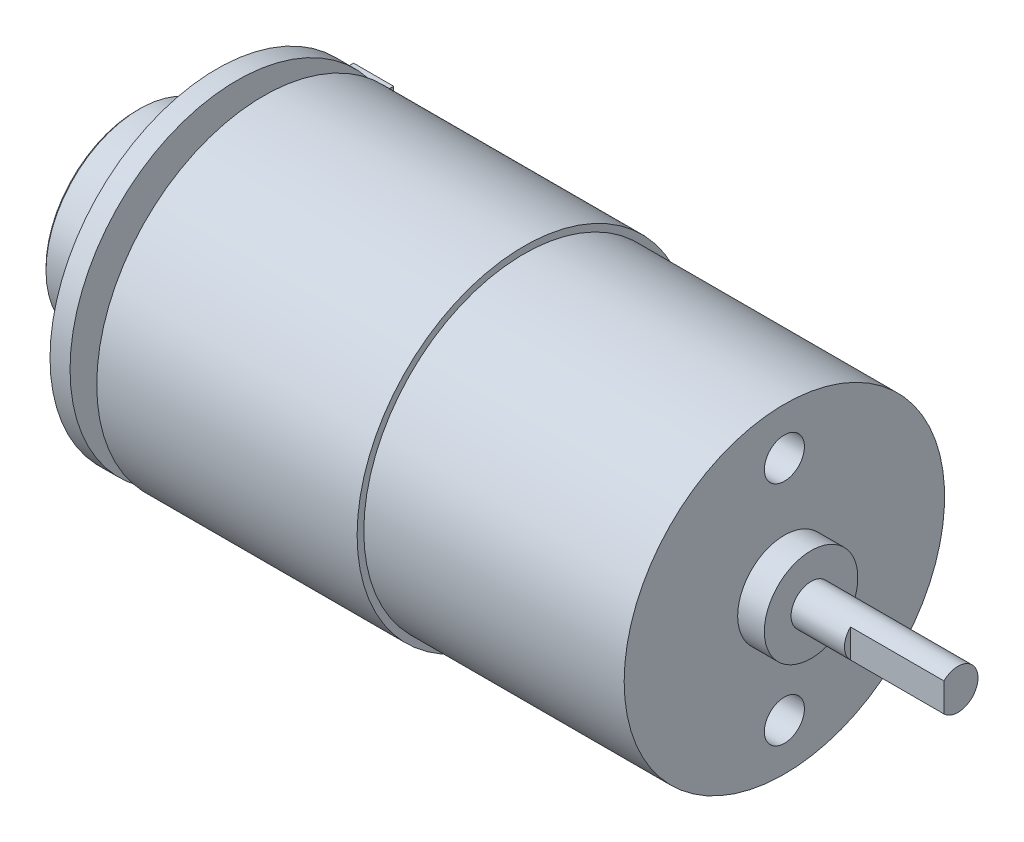
from build123d import *

# Parameters (mm, degrees)
SKETCH_2_R               = 1.5
CUT_EXTRUDE_1_DEPTH      = 3
SKETCH_3_W               = 0.5
SKETCH_3_H               = 3
EXTRUDE_1_DEPTH          = 2
EXTRUDE_START            = 1.5
SKETCH_4_R               = 12.5
EXTRUDE_2_DEPTH          = 1.5
SKETCH_5_R               = 0.5
EXTRUDE_3_DEPTH          = 1
SKETCH_6_R               = 7
EXTRUDE_4_DEPTH          = 5
SKETCH_7_W               = 5
SKETCH_7_H               = 9.498376428
EXTRUDE_5_DEPTH          = 3
CHAMFER_1_SIZE           = 0.2
CUT_EXTRUDE_2_DEPTH      = 38.251363929
CUT_EXTRUDE_2_DEPTH_BACK = 38.251363929
SKETCH_8_W               = 7
SKETCH_8_H               = 0.45


with BuildPart() as part:
    # 草图1 → 旋转1 (revolve)
    with BuildSketch(Plane.XY, mode=Mode.PRIVATE) as revolve_1_sk:
        Polygon((0, 12), (0, 12.5), (-19.5, 12.5), (-19.5, 0), (19.5, 0), (32.5, 0), (32.5, 1.5), (21.5, 1.5), (21.5, 3.5), (19.5, 3.5), (19.5, 12), align=None)
    revolve(revolve_1_sk.sketch.rotate(Axis((-61.965581957, 0, 0), (1, 0, 0)), 90), axis=Axis((-61.965581957, 0, 0), (1, 0, 0)))

    # 草图2 → 切除-拉伸1 (cut)
    with BuildSketch(Plane(origin=(19.5, 0, 0), x_dir=(0, 0, -1), z_dir=(1, 0, 0))):
        with Locations((0, -8.5)):
            Circle(SKETCH_2_R)
        with Locations(Location((0, 8.5, 0), (0, 0, 180))):
            Circle(SKETCH_2_R)
    extrude(amount=-CUT_EXTRUDE_1_DEPTH, mode=Mode.SUBTRACT)

    # 草图3 → 凸台-拉伸1 (add)
    with BuildSketch(Plane.ZY.offset(19.5)):
        with Locations((-9.404663304, 0)):
            Rectangle(SKETCH_3_W, SKETCH_3_H)
        with Locations((9.404663304, 0)):
            Rectangle(SKETCH_3_W, SKETCH_3_H)
    extrude(amount=EXTRUDE_1_DEPTH)

    # 草图4 → 凸台-拉伸2 (add)
    with BuildSketch(Plane.ZY.offset(21.5).offset(EXTRUDE_START)):
        Circle(SKETCH_4_R)
    extrude(amount=-EXTRUDE_2_DEPTH)

    # 草图5 → 凸台-拉伸3 (add)
    with BuildSketch(Plane.ZY.offset(23)):
        Circle(SKETCH_5_R)
    extrude(amount=EXTRUDE_3_DEPTH)

    # 草图6 → 凸台-拉伸4 (add)
    with BuildSketch(Plane.ZY.offset(24)):
        Circle(SKETCH_6_R)
    extrude(amount=EXTRUDE_4_DEPTH)

    # 草图7 → 凸台-拉伸5 (add)
    with BuildSketch(Plane.ZY.offset(23)):
        with Locations((-10.734958049, 0)):
            Rectangle(SKETCH_7_W, SKETCH_7_H)
    extrude(amount=EXTRUDE_5_DEPTH)

    # 倒角1
    chamfer_1_edges = [part.edges().sort_by_distance(p)[0] for p in [
        (-29, 0, -7),
    ]]
    chamfer(chamfer_1_edges, length=CHAMFER_1_SIZE)

    # 草图8 → 切除-拉伸2 (cut, two sides: drawn at the far end of the back side and taken through both)
    with BuildSketch(Plane(origin=(0, 0, 0), x_dir=(1, 0, 0), z_dir=(0, 1, 0)).offset(-CUT_EXTRUDE_2_DEPTH_BACK)):
        with Locations((29, -1.275)):
            Rectangle(SKETCH_8_W, SKETCH_8_H)
    extrude(amount=CUT_EXTRUDE_2_DEPTH + CUT_EXTRUDE_2_DEPTH_BACK, mode=Mode.SUBTRACT)


solid = part.part
